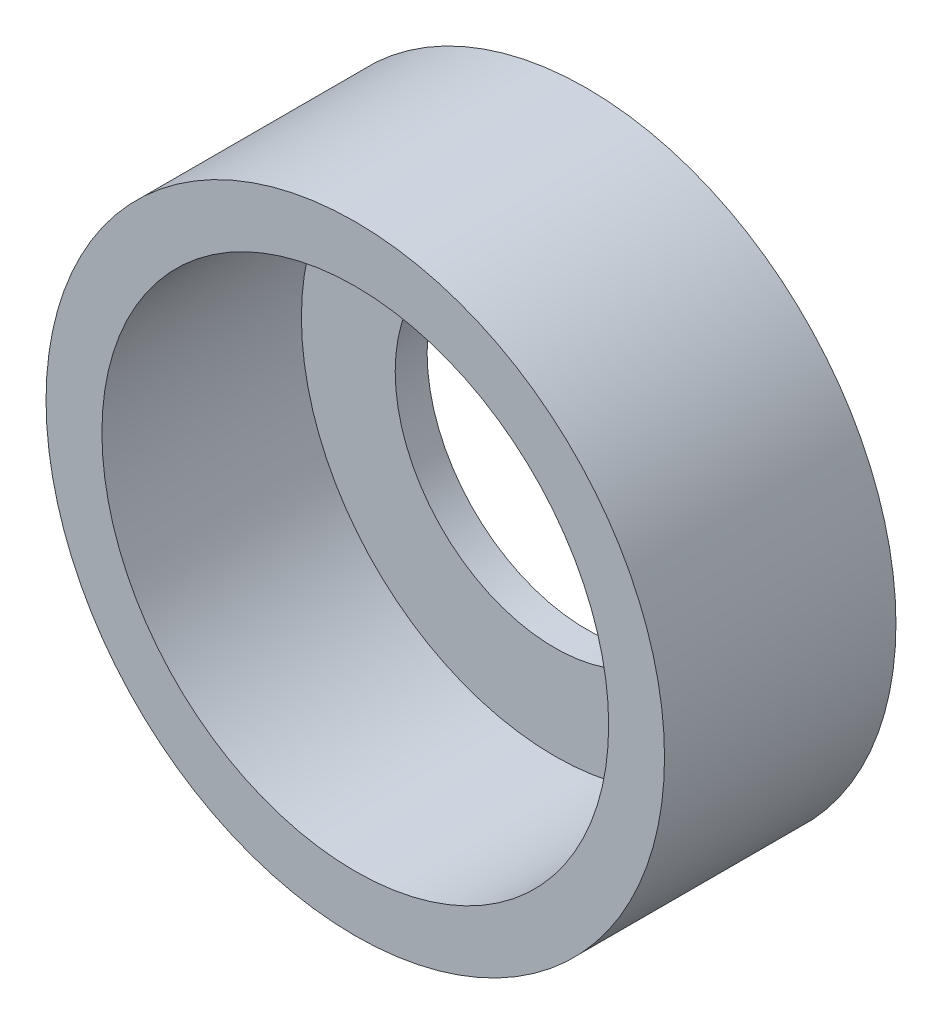
from build123d import *

# Parameters (mm, degrees)
SKETCH1_R           = 3.875
SKETCH1_R_2         = 2
BOSS_EXTRUDE1_DEPTH = 0.4
SKETCH2_R           = 3.875
SKETCH2_R_2         = 3.175
BOSS_EXTRUDE2_DEPTH = 2.5


with BuildPart() as part:
    # Sketch1 → Boss-Extrude1 (new body)
    with BuildSketch(Plane(origin=(0, 0, 0), x_dir=(0, 1, 0), z_dir=(0, 0, 1))):
        Circle(SKETCH1_R)
        Circle(SKETCH1_R_2, mode=Mode.SUBTRACT)
    extrude(amount=BOSS_EXTRUDE1_DEPTH)

    # Sketch2 → Boss-Extrude2 (add)
    with BuildSketch(Plane.XY.offset(0.4)):
        Circle(SKETCH2_R)
        Circle(SKETCH2_R_2, mode=Mode.SUBTRACT)
    extrude(amount=BOSS_EXTRUDE2_DEPTH)


solid = part.part
